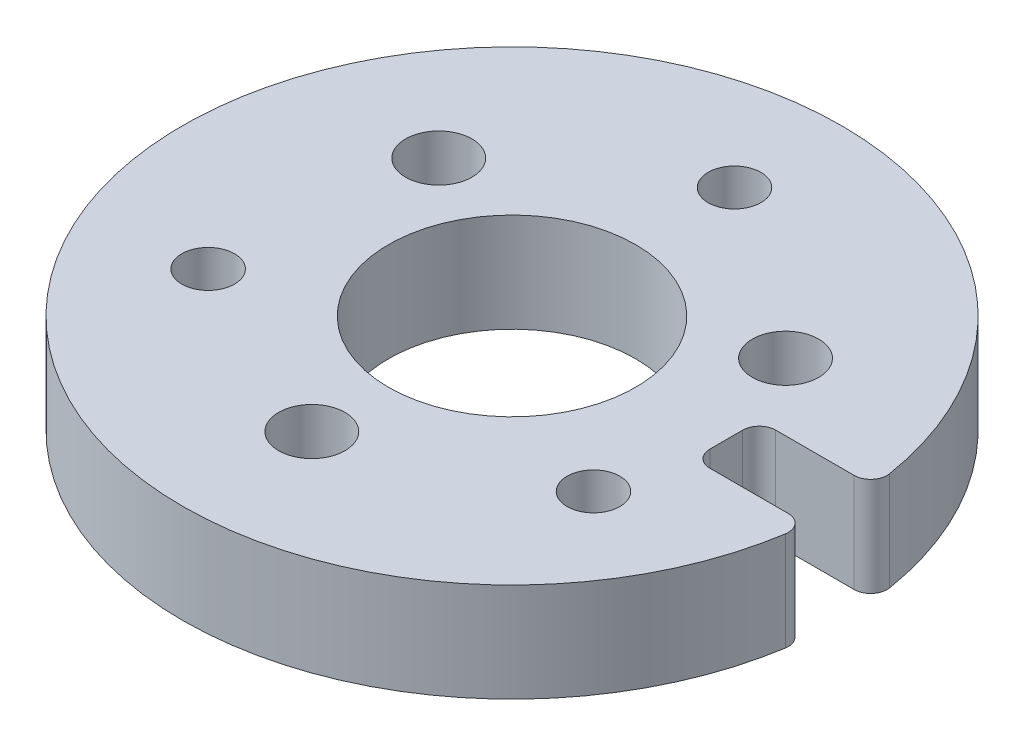
from build123d import *

# Parameters (mm, degrees)
SKETCH_1_R          = 20
SKETCH_1_R_2        = 2.015
SKETCH_1_R_3        = 7.5
SKETCH_1_R_4        = 1.6
EXTRUDE_1_DEPTH     = 6
SKETCH_2_W          = 14.17824661
SKETCH_2_H          = 4
CUT_EXTRUDE_1_DEPTH = 10
FILLET_1_R          = 1


with BuildPart() as part:
    # 草图1 → 凸台-拉伸1 (new body)
    with BuildSketch(Plane(origin=(0, 0, 0), x_dir=(1, 0, 0), z_dir=(0, 1, 0))):
        with Locations(Location((0, 0, 0), (0, 0, 270))):
            Circle(SKETCH_1_R)
        with Locations(Location((0, -12.15, 0), (0, 0, 270))):
            Circle(SKETCH_1_R_2, mode=Mode.SUBTRACT)
        with Locations(Location((10.522208656, 6.075, 0), (0, 0, 270))):
            Circle(SKETCH_1_R_2, mode=Mode.SUBTRACT)
        with Locations(Location((-10.522208656, 6.075, 0), (0, 0, 270))):
            Circle(SKETCH_1_R_2, mode=Mode.SUBTRACT)
        with Locations(Location((0, 0, 0), (0, 0, 270))):
            Circle(SKETCH_1_R_3, mode=Mode.SUBTRACT)
        with Locations(Location((-11.691342951, -6.75, 0), (0, 0, 270))):
            Circle(SKETCH_1_R_4, mode=Mode.SUBTRACT)
        with Locations(Location((11.691342951, -6.75, 0), (0, 0, 270))):
            Circle(SKETCH_1_R_4, mode=Mode.SUBTRACT)
        with Locations(Location((0, 13.5, 0), (0, 0, 270))):
            Circle(SKETCH_1_R_4, mode=Mode.SUBTRACT)
    extrude(amount=EXTRUDE_1_DEPTH)

    # 草图2 → 切除-拉伸1 (cut)
    with BuildSketch(Plane(origin=(0, 6, 0), x_dir=(1, 0, 0), z_dir=(0, 1, 0))):
        with Locations((20.089123305, 0)):
            Rectangle(SKETCH_2_W, SKETCH_2_H)
    extrude(amount=-CUT_EXTRUDE_1_DEPTH, mode=Mode.SUBTRACT)

    # 圆角1
    fillet_1_edges = [part.edges().sort_by_distance(p)[0] for p in [
        (13, 3, 2),
        (19.899748742, 3, -2),
        (13, 3, -2),
        (19.899748742, 3, 2),
    ]]
    fillet(fillet_1_edges, radius=FILLET_1_R)


solid = part.part
